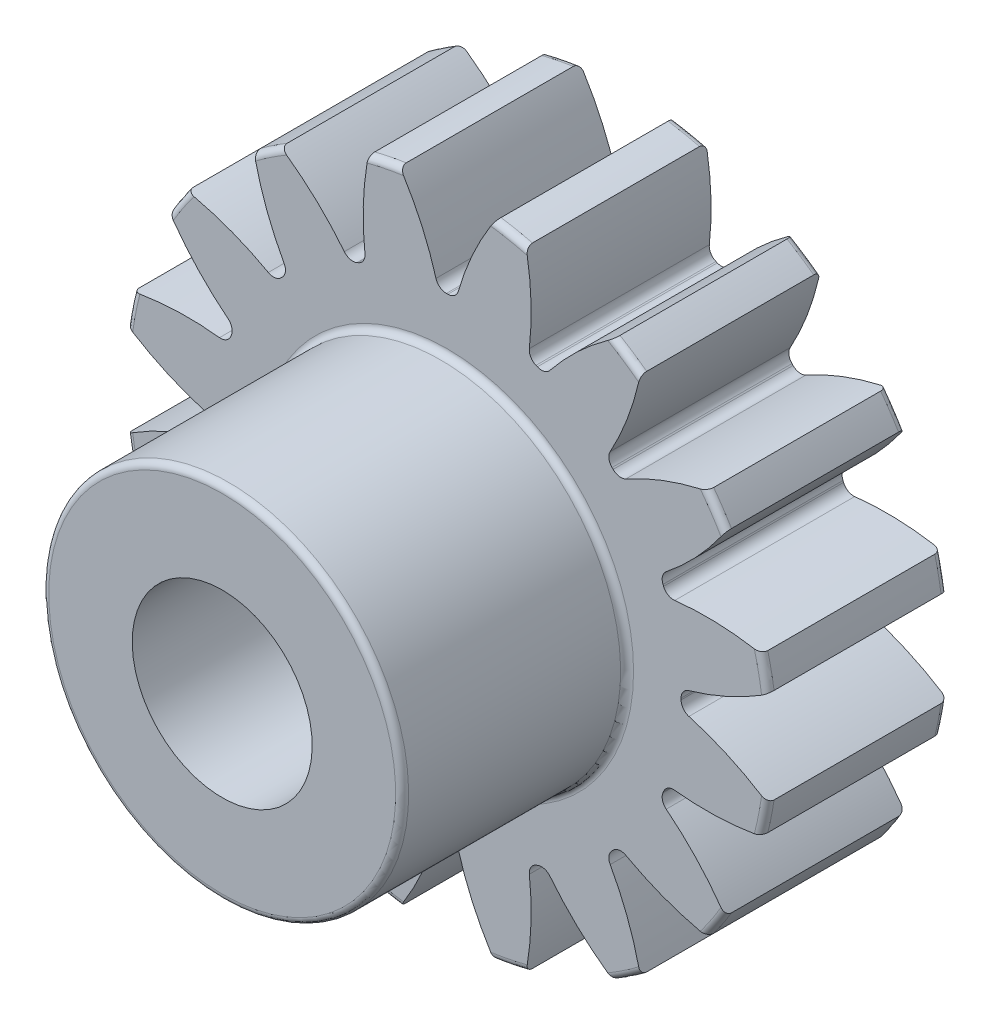
from build123d import *

# Parameters (mm, degrees)
FILLET2_R          = 0.144
CUT_EXTRUDE2_DEPTH = 12.34372073
CIRPATTERN1_COUNT  = 16


with BuildPart() as part:
    # Sketch4 → Revolve1 (revolve)
    with BuildSketch(Plane(origin=(0, 0, 0), x_dir=(0, 0, -1), z_dir=(1, 0, 0))):
        Polygon((-9, 2), (-9, 4), (-4, 4), (-4, 7.2), (0, 7.2), (0, 2), align=None)
    revolve(axis=Axis((0, 0, 4), (0, 0, 1)))

    # Fillet2
    fillet2_edges = [part.edges().sort_by_distance(p)[0] for p in [
        (0, -7.2, 0),
        (0, -7.2, 4),
        (0, -4, 4),
        (0, -4, 9),
    ]]
    fillet(fillet2_edges, radius=FILLET2_R)

    # Sketch7 → Cut-Extrude2 (cut, through all)
    with BuildSketch(Plane.XY.offset(4)):
        with BuildLine():
            ThreePointArc((-0.016690779, 5.199973213), (0, 5.2), (0.016690779, 5.199973213))
            ThreePointArc((0.016690779, 5.199973213), (0.161472587, 5.247976164), (0.24809312, 5.373526707))
            ThreePointArc((0.24809312, 5.373526707), (0.584673155, 6.278479052), (1.05355714, 7.122500779))
            ThreePointArc((1.05355714, 7.122500779), (0, 7.2), (-1.05355714, 7.122500779))
            ThreePointArc((-1.05355714, 7.122500779), (-0.584673155, 6.278479052), (-0.24809312, 5.373526707))
            ThreePointArc((-0.24809312, 5.373526707), (-0.161472587, 5.247976164), (-0.016690779, 5.199973213))
        make_face()
    cut_extrude2 = extrude(amount=-CUT_EXTRUDE2_DEPTH, mode=Mode.SUBTRACT)

    # CirPattern1: Cut-Extrude2 ×16 about axis
    cirpattern1_axis = Axis((0, 0, 0), (0, 0, 1))
    for i in range(1, CIRPATTERN1_COUNT):
        add(cut_extrude2.rotate(cirpattern1_axis, i * 360 / CIRPATTERN1_COUNT), mode=Mode.SUBTRACT)


solid = part.part
